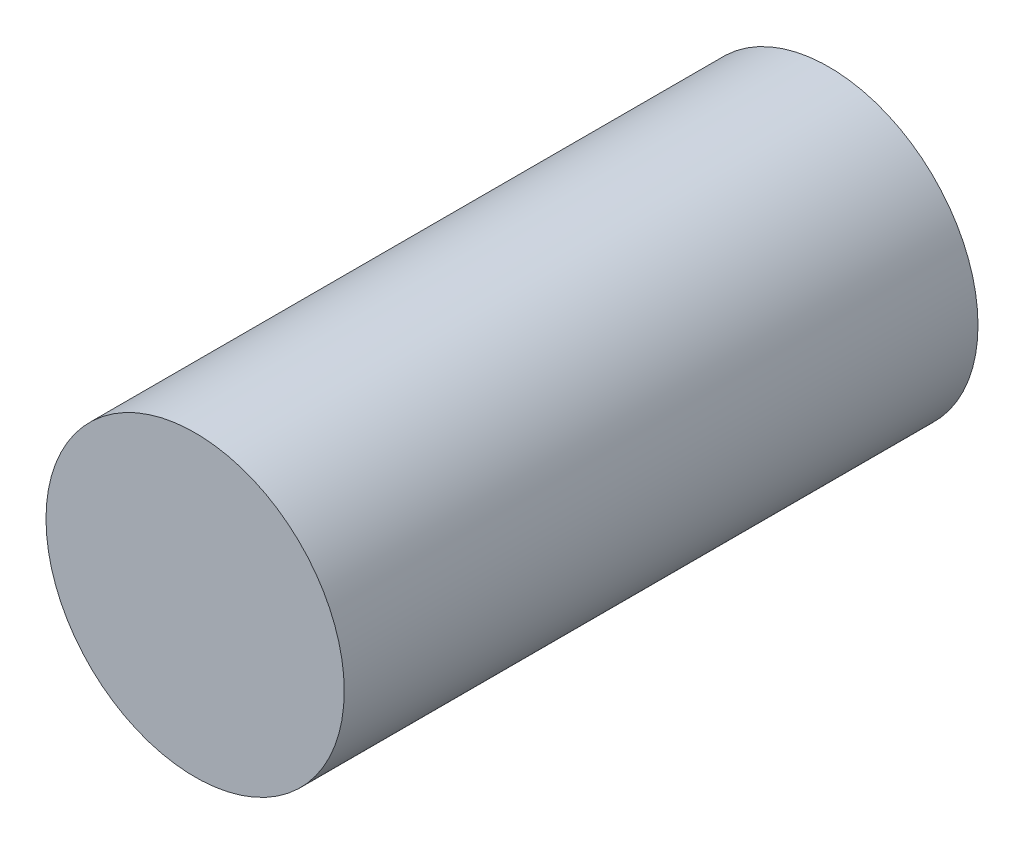
from build123d import *

# Parameters (mm, degrees)
ESBO_O1_R                = 4
RESSALTO_EXTRUS_O1_DEPTH = 17


with BuildPart() as part:
    # Esboço1 → Ressalto-extrusão1 (new body)
    with BuildSketch(Plane.XY):
        Circle(ESBO_O1_R)
    extrude(amount=RESSALTO_EXTRUS_O1_DEPTH)


solid = part.part
